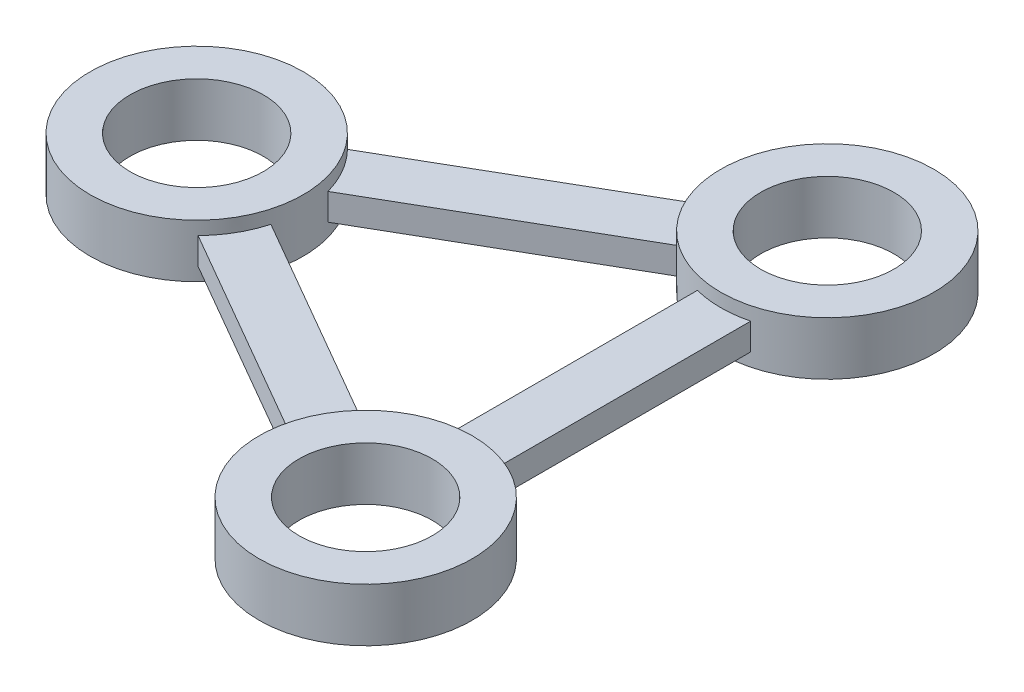
from build123d import *

# Parameters (mm, degrees)
SKETCH1_R             = 40
SKETCH1_R_2           = 25
BOSS_EXTRUDE1_DEPTH   = 10
BOSS_EXTRUDE1_2_DEPTH = 10
BOSS_EXTRUDE1_3_DEPTH = 10
BOSS_EXTRUDE2_DEPTH   = 5


with BuildPart() as part:
    # Sketch1 → Boss-Extrude1 (new, symmetric)
    with BuildSketch(Plane(origin=(0, 0, 0), x_dir=(1, 0, 0), z_dir=(0, 1, 0))):
        with Locations((-150, -86.6)):
            Circle(SKETCH1_R)
        with Locations((-150, -86.6)):
            Circle(SKETCH1_R_2, mode=Mode.SUBTRACT)
    extrude(amount=BOSS_EXTRUDE1_DEPTH, both=True)



with BuildPart() as body_2:
    # Sketch1 → Boss-Extrude1 2 (new, symmetric)
    with BuildSketch(Plane(origin=(0, 0, 0), x_dir=(1, 0, 0), z_dir=(0, 1, 0))):
        Circle(SKETCH1_R)
        Circle(SKETCH1_R_2, mode=Mode.SUBTRACT)
    extrude(amount=BOSS_EXTRUDE1_2_DEPTH, both=True)


with BuildPart() as body_3:
    # Sketch1 → Boss-Extrude1 3 (new, symmetric)
    with BuildSketch(Plane(origin=(0, 0, 0), x_dir=(1, 0, 0), z_dir=(0, 1, 0))):
        with Locations((0, -173.2)):
            Circle(SKETCH1_R)
        with Locations((0, -173.2)):
            Circle(SKETCH1_R_2, mode=Mode.SUBTRACT)
    extrude(amount=BOSS_EXTRUDE1_3_DEPTH, both=True)


with BuildPart() as part_1:
    add(part.part)

    add(body_2.part)  # Boss-Extrude2 merges body 2

    add(body_3.part)  # Boss-Extrude2 merges body 3
    # Sketch1<3> → Boss-Extrude2 (add, symmetric)
    with BuildSketch(Plane(origin=(0, 0, 0), x_dir=(1, 0, 0), z_dir=(0, 1, 0))):
        with BuildLine():
            Line((-38.54115563, -10.704173145), (-121.458624364, -58.575191761))
            ThreePointArc((-121.458624364, -58.575191761), (-115.358729812, -66.600440011), (-111.45884437, -75.895826855))
            Line((-111.45884437, -75.895826855), (-28.541375636, -28.024808239))
            ThreePointArc((-28.541375636, -28.024808239), (-34.641270188, -19.999559989), (-38.54115563, -10.704173145))
        make_face()
        with BuildLine():
            ThreePointArc((-111.45884437, -97.304173145), (-115.358729812, -106.599559989), (-121.458624364, -114.624808239))
            Line((-121.458624364, -114.624808239), (-38.54115563, -162.495826855))
            ThreePointArc((-38.54115563, -162.495826855), (-34.641270188, -153.200440011), (-28.541375636, -145.175191761))
            Line((-28.541375636, -145.175191761), (-111.45884437, -97.304173145))
        make_face()
        with BuildLine():
            Line((10, -134.470166538), (10, -38.729833462))
            ThreePointArc((10, -38.729833462), (0, -40), (-10, -38.729833462))
            Line((-10, -38.729833462), (-10, -134.470166538))
            ThreePointArc((-10, -134.470166538), (0, -133.2), (10, -134.470166538))
        make_face()
    extrude(amount=BOSS_EXTRUDE2_DEPTH, both=True)


solid = part_1.part
